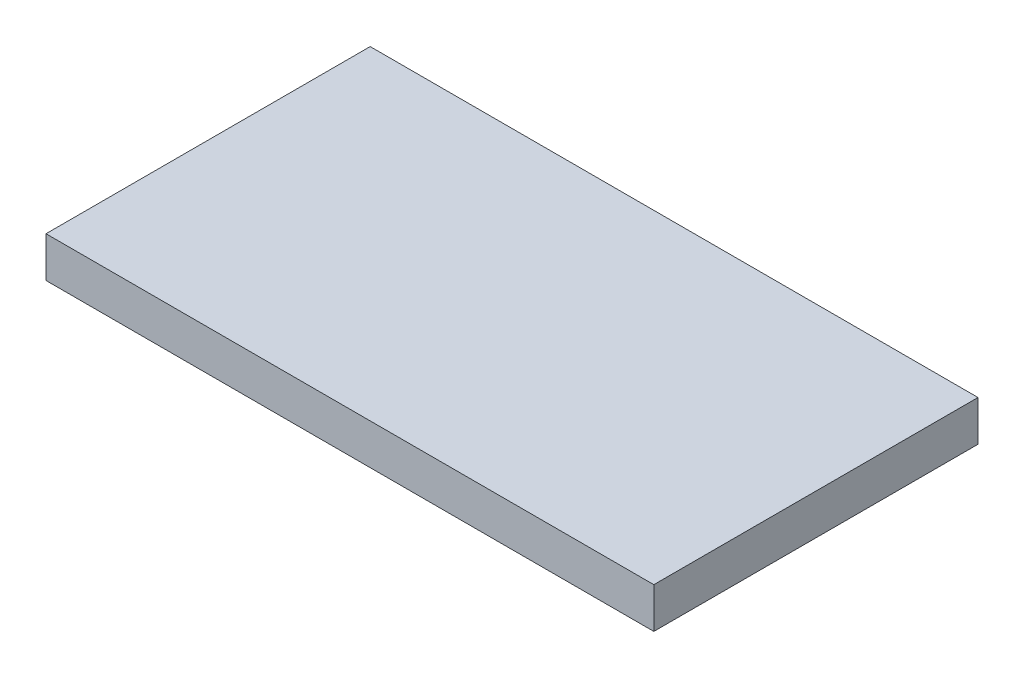
from build123d import *

# Parameters (mm, degrees)
SKETCH2_W           = 1500
SKETCH2_H           = 800
BOSS_EXTRUDE1_DEPTH = 100


with BuildPart() as part:
    # Sketch2 → Boss-Extrude1 (new body)
    with BuildSketch(Plane(origin=(0, 0, 0), x_dir=(1, 0, 0), z_dir=(0, 1, 0))):
        Rectangle(SKETCH2_W, SKETCH2_H)
    extrude(amount=BOSS_EXTRUDE1_DEPTH)


solid = part.part
